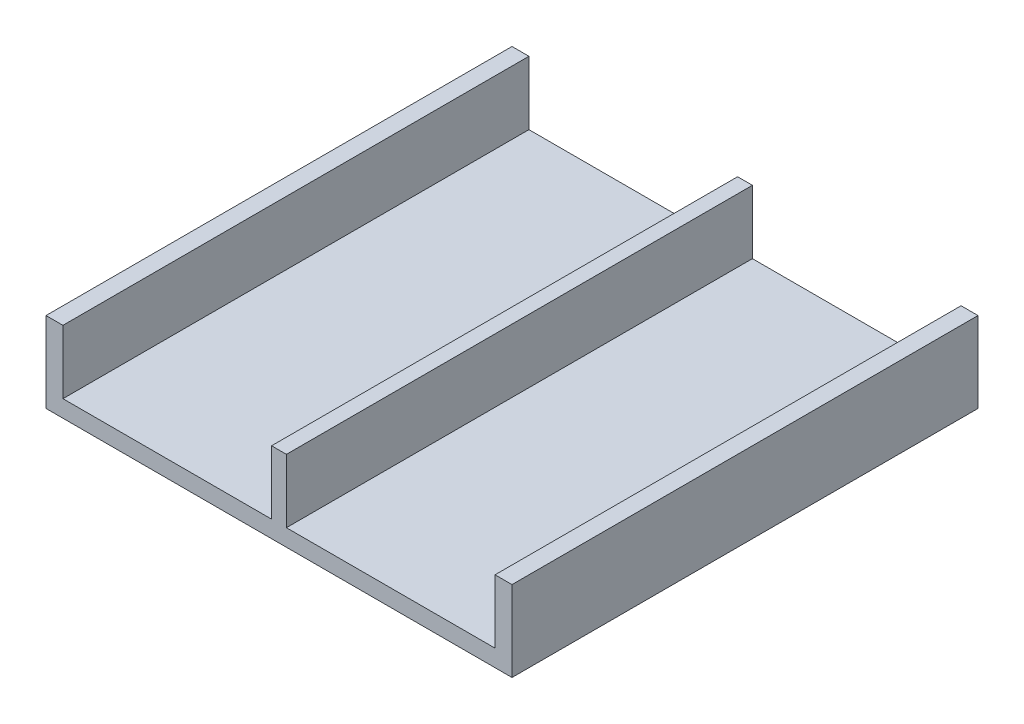
from build123d import *

# Parameters (mm, degrees)
SKETCH1_W           = 110
SKETCH1_H           = 110
BOSS_EXTRUDE1_DEPTH = 19
SKETCH2_W           = 49.25
SKETCH2_H           = 110
CUT_EXTRUDE2_DEPTH  = 15


with BuildPart() as part:
    # Sketch1 → Boss-Extrude1 (new body)
    with BuildSketch(Plane(origin=(0, 0, 0), x_dir=(1, 0, 0), z_dir=(0, 1, 0))):
        Rectangle(SKETCH1_W, SKETCH1_H)
    extrude(amount=BOSS_EXTRUDE1_DEPTH)

    # Sketch2 → Cut-Extrude2 (cut)
    with BuildSketch(Plane(origin=(0, 19, 0), x_dir=(1, 0, 0), z_dir=(0, 1, 0))):
        with Locations((-26.375, 0)):
            Rectangle(SKETCH2_W, SKETCH2_H)
        with Locations((26.375, 0)):
            Rectangle(SKETCH2_W, SKETCH2_H)
    extrude(amount=-CUT_EXTRUDE2_DEPTH, mode=Mode.SUBTRACT)


solid = part.part
